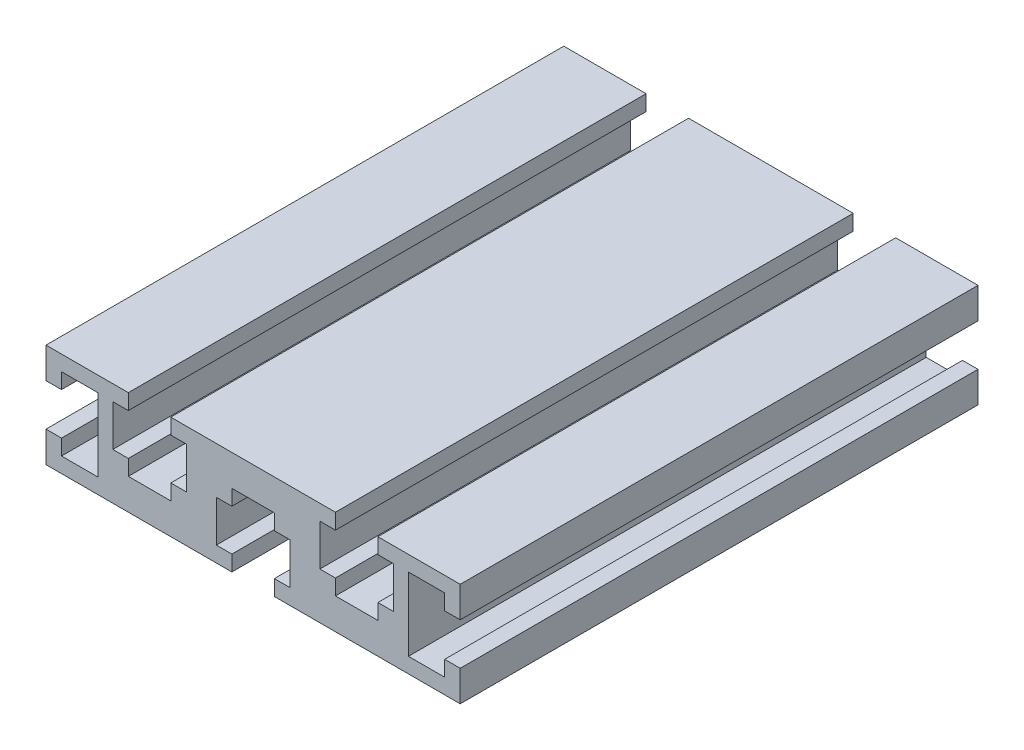
from build123d import *

# Parameters (mm, degrees)
EXTRUDE_1_DEPTH = 100


with BuildPart() as part:
    # 草图1 → 凸台-拉伸1 (new body)
    with BuildSketch(Plane.XY):
        Polygon((-12.227051006, -6.257565337), (-15.227051006, -6.257565337), (-15.227051006, 1.742434663), (-12.227051006, 1.742434663), (-12.227051006, 4.742434663), (-4.027051006, 4.742434663), (-4.027051006, 1.742434663), (-1.027051006, 1.742434663), (-1.027051006, -6.257565337), (-4.027051006, -6.257565337), (-4.027051006, -9.257565337), (31.872948994, -9.257565337), (31.872948994, -3.307565337), (28.872948994, -3.307565337), (28.872948994, -6.307565337), (21.872948994, -6.307565337), (21.872948994, 7.792434663), (28.872948994, 7.792434663), (28.872948994, 4.792434663), (31.872948994, 4.792434663), (31.872948994, 10.742434663), (15.972948994, 10.742434663), (15.972948994, 7.742434663), (18.972948994, 7.742434663), (18.972948994, -0.257565337), (15.972948994, -0.257565337), (15.972948994, -3.257565337), (7.772948994, -3.257565337), (7.772948994, -0.257565337), (4.772948994, -0.257565337), (4.772948994, 7.742434663), (7.772948994, 7.742434663), (7.772948994, 10.742434663), (-24.027051006, 10.742434663), (-24.027051006, 7.742434663), (-21.027051006, 7.742434663), (-21.027051006, -0.257565337), (-24.027051006, -0.257565337), (-24.027051006, -3.257565337), (-32.227051006, -3.257565337), (-32.227051006, -0.257565337), (-35.227051006, -0.257565337), (-35.227051006, 7.742434663), (-32.227051006, 7.742434663), (-32.227051006, 10.742434663), (-48.127051006, 10.742434663), (-48.127051006, 4.792434663), (-45.127051006, 4.792434663), (-45.127051006, 7.792434663), (-38.127051006, 7.792434663), (-38.127051006, -6.307565337), (-45.127051006, -6.307565337), (-45.127051006, -3.307565337), (-48.127051006, -3.307565337), (-48.127051006, -9.257565337), (-12.227051006, -9.257565337), align=None)
    extrude(amount=EXTRUDE_1_DEPTH)


solid = part.part
